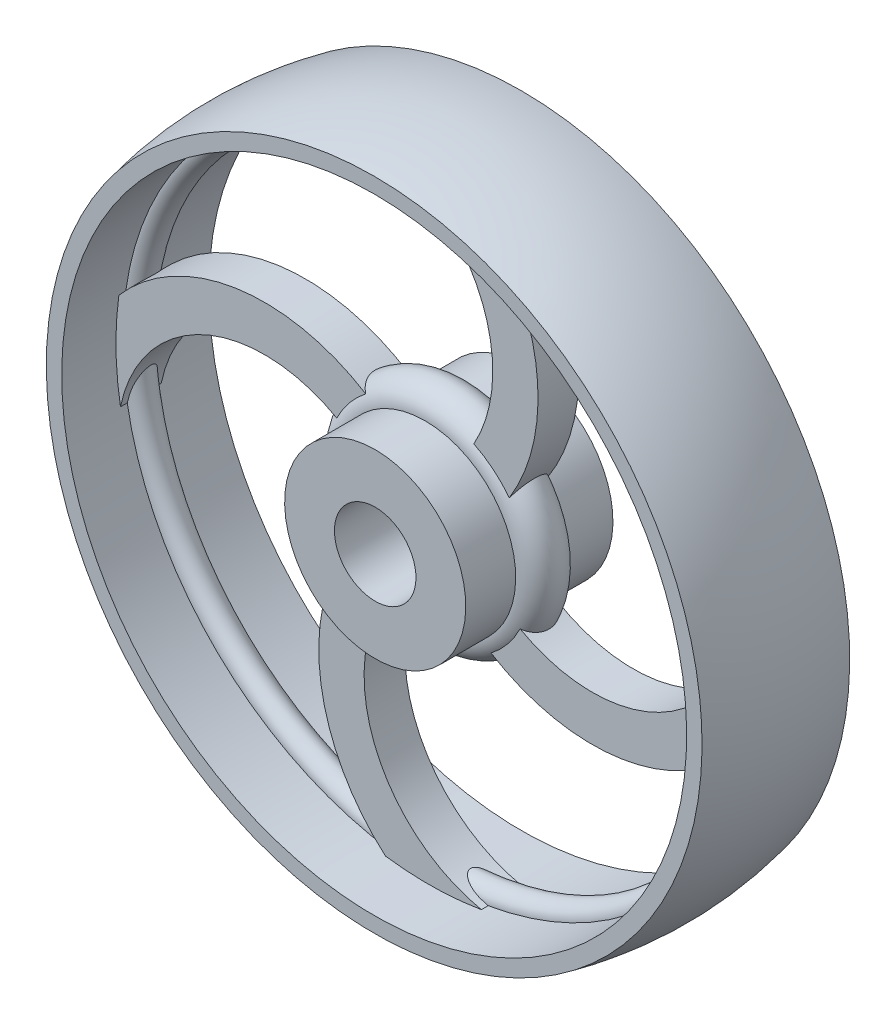
from build123d import *

# Parameters (mm, degrees)
BOSS_EXTRUDE3_DEPTH = 9
CIRPATTERN1_COUNT   = 4


with BuildPart() as part:
    # Sweep1: sweep along a path in Sketch1
    with BuildLine(Plane.XY) as sweep1_path:
        CenterArc((0, 0), 145, 0, 360)
    # Sketch2 → Sweep1 (sweep)
    with BuildSketch(Plane(origin=(0, 0, 0), x_dir=(0, 0, -1), z_dir=(1, 0, 0))):
        with BuildLine():
            Line((5.999166033, 138), (32.050741021, 138))
            Line((32.050741021, 138), (32.050741021, 145))
            ThreePointArc((32.050741021, 145), (-0.460420914, 148.499286236), (-32.949258979, 144.798467992))
            Line((-32.949258979, 144.798467992), (-32.949258979, 138))
            Line((-32.949258979, 138), (-5.999166033, 138))
            ThreePointArc((-5.999166033, 138), (0, 131.899965493), (5.999166033, 138))
        make_face()
    sweep(path=sweep1_path.line)



with BuildPart() as body_2:
    # Sweep2: sweep along a path in Sketch3
    with BuildLine(Plane.XY) as sweep2_path:
        CenterArc((0, 0), 40, 0, 360)
    # Sketch4 → Sweep2 (sweep)
    with BuildSketch(Plane(origin=(0, 0, 0), x_dir=(0, 0, -1), z_dir=(1, 0, 0))):
        with BuildLine():
            Line((-32.5, 40), (-10.449258979, 40))
            ThreePointArc((-10.449258979, 40), (-0.449258979, 50), (9.550741021, 40))
            Line((9.550741021, 40), (32.5, 40))
            Line((32.5, 40), (32.5, 18))
            Line((32.5, 18), (-32.5, 18))
            Line((-32.5, 18), (-32.5, 40))
        make_face()
    sweep(path=sweep2_path.line)


with BuildPart() as part_1:
    add(part.part)

    add(body_2.part)  # Boss-Extrude3 merges body 2
    # Sketch10 → Boss-Extrude3 (add, symmetric)
    with BuildSketch(Plane.XY):
        with BuildLine():
            ThreePointArc((17.330404885, 36.050756809), (23.609351815, 96.881391078), (-23.394040608, 136.002642857))
            ThreePointArc((-23.394040608, 136.002642857), (-2.240713474, 137.981807508), (18.965722986, 136.690531317))
            ThreePointArc((18.965722986, 136.690531317), (47.802187213, 82.535824261), (32.671857062, 23.077039588))
            ThreePointArc((32.671857062, 23.077039588), (25.828973742, 30.542824287), (17.330404885, 36.050756809))
        make_face()
    boss_extrude3 = extrude(amount=BOSS_EXTRUDE3_DEPTH, both=True)

    # CirPattern1: Boss-Extrude3 ×4 about axis
    cirpattern1_axis = Axis((0, 0, 0), (0, 0, 1))
    for i in range(1, CIRPATTERN1_COUNT):
        add(boss_extrude3.rotate(cirpattern1_axis, i * 360 / CIRPATTERN1_COUNT))


solid = part_1.part
